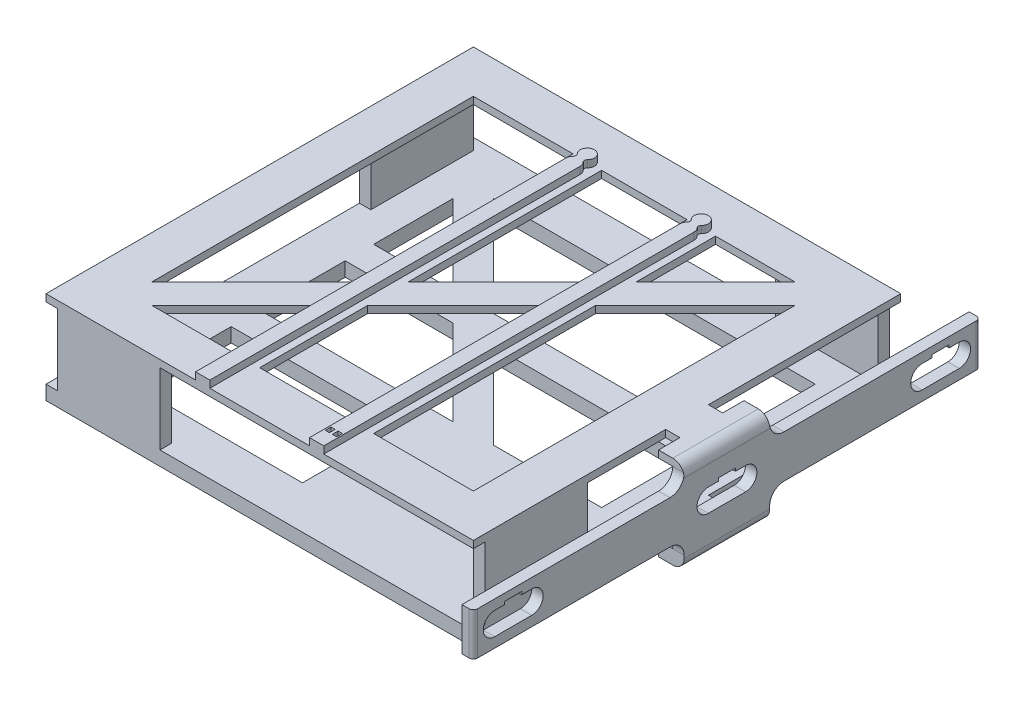
from build123d import *

# Parameters (mm, degrees)
SKETCH_1_W          = 120
SKETCH_1_H          = 70
EXTRUDE_1_DEPTH     = 5
SKETCH_2_W          = 120
SKETCH_2_H          = 70
EXTRUDE_2_DEPTH     = 5
SKETCH_3_W          = 8
SKETCH_3_H          = 72
SKETCH_3_W_2        = 72
SKETCH_3_H_2        = 8
EXTRUDE_3_DEPTH     = 50
SKETCH_4_W          = 300
SKETCH_4_H          = 300
EXTRUDE_4_DEPTH     = 5
EXTRUDE_5_DEPTH     = 5
SKETCH_6_W          = 4
SKETCH_6_H          = 3
CUT_EXTRUDE_1_DEPTH = 3
SKETCH_7_R          = 0.4
CUT_EXTRUDE_2_DEPTH = 3
SKETCH_8_W          = 3
SKETCH_8_H          = 4
CUT_EXTRUDE_3_DEPTH = 3
SKETCH_9_R          = 0.4
CUT_EXTRUDE_4_DEPTH = 3
EXTRUDE_6_DEPTH     = 5
EXTRUDE_7_DEPTH     = 10
EXTRUDE_8_DEPTH     = 50
CUT_EXTRUDE_7_DEPTH = 8
FILLET_1_R          = 8
FILLET_2_R          = 8
FILLET_3_R          = 3


with BuildPart() as part:
    # 草图1 → 凸台-拉伸1 (new body)
    with BuildSketch(Plane(origin=(0, 0, 0), x_dir=(1, 0, 0), z_dir=(0, 1, 0))):
        Polygon((-150, 150), (150, 150), (150, -30), (150, -150), (0, -150), (-150, -150), align=None)
        Polygon((-15.857864376, 30), (120, 30), (120, -30), (44.142135624, -30), align=None, mode=Mode.SUBTRACT)
        Polygon((-105.857864376, 120), (120, 120), (120, 50), (-35.857864376, 50), align=None, mode=Mode.SUBTRACT)
        Polygon((-120, 105.857864376), (-120, 50), (-64.142135624, 50), align=None, mode=Mode.SUBTRACT)
        with Locations((-60, -85)):
            Rectangle(SKETCH_1_W, SKETCH_1_H, mode=Mode.SUBTRACT)
        Polygon((-120, 30), (-44.142135624, 30), (15.857864376, -30), (-120, -30), align=None, mode=Mode.SUBTRACT)
    extrude(amount=EXTRUDE_1_DEPTH)

    # 草图2 → 凸台-拉伸2 (add)
    with BuildSketch(Plane.XZ):
        with BuildLine():
            Line((150, 45), (150, 150))
            Line((150, 150), (-150, 150))
            Line((-150, 150), (-150, -150))
            Line((-150, -150), (150, -150))
            Line((150, -150), (150, -45))
            Line((150, -45), (-110, -45))
            ThreePointArc((-110, -45), (-111.913417162, -44.619397663), (-113.535533906, -43.535533906))
            ThreePointArc((-113.535533906, -43.535533906), (-115, -42.928932188), (-116.464466094, -43.535533906))
            ThreePointArc((-116.464466094, -43.535533906), (-125, -40), (-116.464466094, -36.464466094))
            ThreePointArc((-116.464466094, -36.464466094), (-115, -37.071067812), (-113.535533906, -36.464466094))
            ThreePointArc((-113.535533906, -36.464466094), (-111.913417162, -35.380602337), (-110, -35))
            Line((-110, -35), (150, -35))
            Line((150, -35), (150, 35))
            Line((150, 35), (-110, 35))
            ThreePointArc((-110, 35), (-111.913417162, 35.380602337), (-113.535533906, 36.464466094))
            ThreePointArc((-113.535533906, 36.464466094), (-115, 37.071067812), (-116.464466094, 36.464466094))
            ThreePointArc((-116.464466094, 36.464466094), (-125, 40), (-116.464466094, 43.535533906))
            ThreePointArc((-116.464466094, 43.535533906), (-115, 42.928932188), (-113.535533906, 43.535533906))
            ThreePointArc((-113.535533906, 43.535533906), (-111.913417162, 44.619397663), (-110, 45))
            Line((-110, 45), (150, 45))
        make_face()
        with Locations((-60, 85)):
            Rectangle(SKETCH_2_W, SKETCH_2_H, mode=Mode.SUBTRACT)
        Polygon((-120, 30), (-120, -30), (-44.142135624, -30), (15.857864376, 30), align=None, mode=Mode.SUBTRACT)
        Polygon((44.142135624, 30), (-15.857864376, -30), (120, -30), (120, 30), align=None, mode=Mode.SUBTRACT)
        Polygon((-120, -50), (-120, -105.857864376), (-64.142135624, -50), align=None, mode=Mode.SUBTRACT)
        Polygon((-35.857864376, -50), (-105.857864376, -120), (120, -120), (120, -50), align=None, mode=Mode.SUBTRACT)
    extrude(amount=EXTRUDE_2_DEPTH)

    # 草图3 → 凸台-拉伸3 (add)
    with BuildSketch(Plane(origin=(0, 5, 0), x_dir=(1, 0, 0), z_dir=(0, 1, 0))):
        with Locations((146, -106)):
            Rectangle(SKETCH_3_W, SKETCH_3_H)
        with Locations((-106, -146)):
            Rectangle(SKETCH_3_W_2, SKETCH_3_H_2)
        with Locations((-146, 106)):
            Rectangle(SKETCH_3_W, SKETCH_3_H)
        with Locations((106, 146)):
            Rectangle(SKETCH_3_W_2, SKETCH_3_H_2)
    extrude(amount=EXTRUDE_3_DEPTH)

    # 草图4 → 凸台-拉伸4 (add)
    with BuildSketch(Plane(origin=(0, 55, 0), x_dir=(1, 0, 0), z_dir=(0, 1, 0))):
        Rectangle(SKETCH_4_W, SKETCH_4_H)
        Polygon((30, 120), (-30, 120), (-30, -15.857864376), (30, 44.142135624), align=None, mode=Mode.SUBTRACT)
        Polygon((105.857864376, 120), (50, 120), (50, 64.142135624), align=None, mode=Mode.SUBTRACT)
        Polygon((120, 105.857864376), (120, -120), (50, -120), (50, 35.857864376), align=None, mode=Mode.SUBTRACT)
        Polygon((-120, 120), (-120, -105.857864376), (-50, -35.857864376), (-50, 120), align=None, mode=Mode.SUBTRACT)
        Polygon((-50, -120), (-105.857864376, -120), (-50, -64.142135624), align=None, mode=Mode.SUBTRACT)
        Polygon((30, -120), (-30, -120), (-30, -44.142135624), (30, 15.857864376), align=None, mode=Mode.SUBTRACT)
    extrude(amount=EXTRUDE_4_DEPTH)

    # 草图5 → 凸台-拉伸5 (add)
    with BuildSketch(Plane(origin=(0, 60, 0), x_dir=(1, 0, 0), z_dir=(0, 1, 0))):
        with BuildLine():
            Line((35, 110), (35, -150))
            Line((35, -150), (45, -150))
            Line((45, -150), (45, 110))
            ThreePointArc((45, 110), (44.619397663, 111.913417162), (43.535533906, 113.535533906))
            ThreePointArc((43.535533906, 113.535533906), (42.928932188, 115), (43.535533906, 116.464466094))
            ThreePointArc((43.535533906, 116.464466094), (40, 125), (36.464466094, 116.464466094))
            ThreePointArc((36.464466094, 116.464466094), (37.071067812, 115), (36.464466094, 113.535533906))
            ThreePointArc((36.464466094, 113.535533906), (35.380602337, 111.913417162), (35, 110))
        make_face()
        with BuildLine():
            Line((-45, -150), (-35, -150))
            Line((-35, -150), (-35, 110))
            ThreePointArc((-35, 110), (-35.380602337, 111.913417162), (-36.464466094, 113.535533906))
            ThreePointArc((-36.464466094, 113.535533906), (-37.071067812, 115), (-36.464466094, 116.464466094))
            ThreePointArc((-36.464466094, 116.464466094), (-40, 125), (-43.535533906, 116.464466094))
            ThreePointArc((-43.535533906, 116.464466094), (-42.928932188, 115), (-43.535533906, 113.535533906))
            ThreePointArc((-43.535533906, 113.535533906), (-44.619397663, 111.913417162), (-45, 110))
            Line((-45, 110), (-45, -150))
        make_face()
    extrude(amount=EXTRUDE_5_DEPTH)

    # 草图6 → 切除-拉伸1 (cut)
    with BuildSketch(Plane.XZ):
        with Locations((138, 42.5)):
            Rectangle(SKETCH_6_W, SKETCH_6_H)
        with Locations((138, 37.5)):
            Rectangle(SKETCH_6_W, SKETCH_6_H)
    extrude(amount=-CUT_EXTRUDE_1_DEPTH, mode=Mode.SUBTRACT)

    # 草图7 → 切除-拉伸2 (cut)
    with BuildSketch(Plane.XZ.offset(-3)):
        with Locations(Location((138, 43.5, 0), (0, 0, 270))):
            Circle(SKETCH_7_R)
        with Locations(Location((138, 41.5, 0), (0, 0, 90))):
            Circle(SKETCH_7_R)
        with Locations(Location((138, 36.5, 0), (0, 0, 90))):
            Circle(SKETCH_7_R)
        with Locations(Location((138, 38.5, 0), (0, 0, 270))):
            Circle(SKETCH_7_R)
    extrude(amount=-CUT_EXTRUDE_2_DEPTH, mode=Mode.SUBTRACT)

    # 草图8 → 切除-拉伸3 (cut)
    with BuildSketch(Plane(origin=(0, 65, 0), x_dir=(1, 0, 0), z_dir=(0, 1, 0))):
        with Locations((37.5, -138)):
            Rectangle(SKETCH_8_W, SKETCH_8_H)
        with Locations((42.5, -138)):
            Rectangle(SKETCH_8_W, SKETCH_8_H)
    extrude(amount=-CUT_EXTRUDE_3_DEPTH, mode=Mode.SUBTRACT)

    # 草图9 → 切除-拉伸4 (cut)
    with BuildSketch(Plane(origin=(0, 62, 0), x_dir=(1, 0, 0), z_dir=(0, 1, 0))):
        with Locations(Location((43.5, -138, 0), (0, 0, 270))):
            Circle(SKETCH_9_R)
        with Locations(Location((41.5, -138, 0), (0, 0, 270))):
            Circle(SKETCH_9_R)
        with Locations(Location((36.5, -138, 0), (0, 0, 90))):
            Circle(SKETCH_9_R)
        with Locations(Location((38.5, -138, 0), (0, 0, 90))):
            Circle(SKETCH_9_R)
    extrude(amount=-CUT_EXTRUDE_4_DEPTH, mode=Mode.SUBTRACT)

    # 草图11 → 凸台-拉伸6 (add)
    with BuildSketch(Plane(origin=(0, 60, 0), x_dir=(1, 0, 0), z_dir=(0, 1, 0))):
        Polygon((150, 15), (160, 15), (160, 30), (178, 30), (178, -30), (160, -30), (160, -15), (150, -15), align=None)
    extrude(amount=-EXTRUDE_6_DEPTH)

    # 草图10 → 凸台-拉伸7 (add)
    with BuildSketch(Plane(origin=(0, 5, 0), x_dir=(1, 0, 0), z_dir=(0, 1, 0))):
        Polygon((150, 15), (160, 15), (160, 30), (178, 30), (178, -30), (160, -30), (160, -15), (150, -15), align=None)
    extrude(amount=-EXTRUDE_7_DEPTH)

    # 草图12 → 凸台-拉伸8 (add)
    with BuildSketch(Plane(origin=(0, 5, 0), x_dir=(1, 0, 0), z_dir=(0, 1, 0))):
        Polygon((178, 30), (178, 178), (170, 178), (170, -178), (178, -178), align=None)
    extrude(amount=EXTRUDE_8_DEPTH)

    # 草图13 → 切除-拉伸7 (cut)
    with BuildSketch(Plane(origin=(178, 0, 0), x_dir=(0, 0, -1), z_dir=(1, 0, 0))):
        with BuildLine():
            Line((40, 15), (178, 15))
            Line((178, 15), (178, 5))
            Line((178, 5), (30, 5))
            ThreePointArc((30, 5), (32.928932188, 12.071067812), (40, 15))
        make_face()
        with BuildLine():
            Line((40, 45), (178, 45))
            Line((178, 45), (178, 55))
            Line((178, 55), (30, 55))
            ThreePointArc((30, 55), (32.928932188, 47.928932188), (40, 45))
        make_face()
        with BuildLine():
            Line((-6, 38), (-13, 38))
            ThreePointArc((-13, 38), (-21, 30), (-13, 22))
            Line((-13, 22), (13, 22))
            ThreePointArc((13, 22), (21, 30), (13, 38))
            Line((13, 38), (6, 38))
            Line((6, 38), (6, 40))
            Line((6, 40), (-6, 40))
            Line((-6, 40), (-6, 38))
        make_face()
        with BuildLine():
            Line((137, 22), (163, 22))
            ThreePointArc((163, 22), (171, 30), (163, 38))
            Line((163, 38), (156, 38))
            Line((156, 38), (156, 40))
            Line((156, 40), (144, 40))
            Line((144, 40), (144, 38))
            Line((144, 38), (137, 38))
            ThreePointArc((137, 38), (129, 30), (137, 22))
        make_face()
        with BuildLine():
            Line((-30, 55), (-178, 55))
            Line((-178, 55), (-178, 45))
            Line((-178, 45), (-40, 45))
            ThreePointArc((-40, 45), (-32.928932188, 47.928932188), (-30, 55))
        make_face()
        with BuildLine():
            Line((-178, 15), (-40, 15))
            ThreePointArc((-40, 15), (-32.928932188, 12.071067812), (-30, 5))
            Line((-30, 5), (-178, 5))
            Line((-178, 5), (-178, 15))
        make_face()
        with BuildLine():
            Line((-163, 22), (-137, 22))
            ThreePointArc((-137, 22), (-129, 30), (-137, 38))
            Line((-137, 38), (-144, 38))
            Line((-144, 38), (-144, 40))
            Line((-144, 40), (-156, 40))
            Line((-156, 40), (-156, 38))
            Line((-156, 38), (-163, 38))
            ThreePointArc((-163, 38), (-171, 30), (-163, 22))
        make_face()
    extrude(amount=-CUT_EXTRUDE_7_DEPTH, mode=Mode.SUBTRACT)

    # 圆角1
    fillet_1_edges = [part.edges().sort_by_distance(p)[0] for p in [
        (178, 60, 0),
    ]]
    fillet(fillet_1_edges, radius=FILLET_1_R)

    # 圆角2
    fillet_2_edges = [part.edges().sort_by_distance(p)[0] for p in [
        (178, -5, 0),
    ]]
    fillet(fillet_2_edges, radius=FILLET_2_R)

    # 圆角3
    fillet_3_edges = [part.edges().sort_by_distance(p)[0] for p in [
        (178, 30, 178),
        (178, 30, -178),
    ]]
    fillet(fillet_3_edges, radius=FILLET_3_R)


solid = part.part
